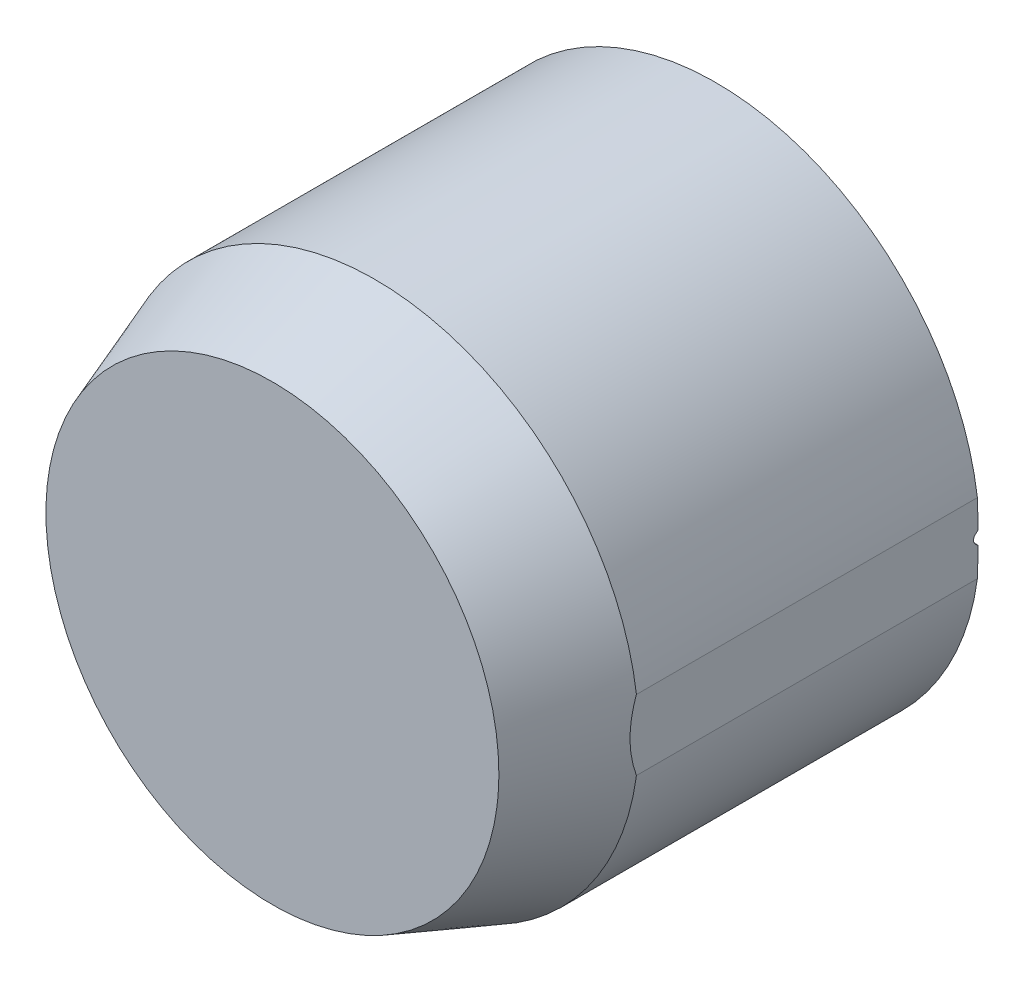
from build123d import *

# Parameters (mm, degrees)
SKETCH2_W               = 3.87532504
SKETCH2_H               = 22.790076604
CUT_EXTRUDE1_DEPTH      = 21.133554083
CUT_EXTRUDE2_DEPTH      = 21.133554083
CUT_EXTRUDE2_DEPTH_BACK = 21.133554083


with BuildPart() as part:
    # Sketch1 → Revolve1 (revolve)
    with BuildSketch(Plane(origin=(0, 0, 0), x_dir=(0, 0, -1), z_dir=(1, 0, 0)), mode=Mode.PRIVATE) as revolve1_sk:
        Polygon((0, 0), (15.6, 0), (15.6, 7.25), (15.131088913, 9), (3.5, 9), (0, 7.72610418), align=None)
    revolve(revolve1_sk.sketch.rotate(Axis((0, 0, 0), (0, 0, -1)), 97.645107459), axis=Axis((0, 0, 0), (0, 0, -1)))

    # Sketch2 → Cut-Extrude1 (cut, through all)
    with BuildSketch(Plane.XY):
        with Locations((10.85766252, -0.726684939)):
            Rectangle(SKETCH2_W, SKETCH2_H)
    extrude(amount=-CUT_EXTRUDE1_DEPTH, mode=Mode.SUBTRACT)

    # Sketch3 → Cut-Extrude2 (cut, two sides: drawn at the far end of the back side and taken through both)
    with BuildSketch(Plane(origin=(0, 0, 0), x_dir=(0, 0, -1), z_dir=(1, 0, 0)).offset(-CUT_EXTRUDE2_DEPTH_BACK)):
        with BuildLine():
            Line((15.070887618, 0.152741588), (15.6, 0.6))
            Line((15.6, 0.6), (15.6, -0.6))
            Line((15.6, -0.6), (15.070887618, -0.152741588))
            ThreePointArc((15.070887618, -0.152741588), (15, 0), (15.070887618, 0.152741588))
        make_face()
    extrude(amount=CUT_EXTRUDE2_DEPTH + CUT_EXTRUDE2_DEPTH_BACK, mode=Mode.SUBTRACT)


solid = part.part
